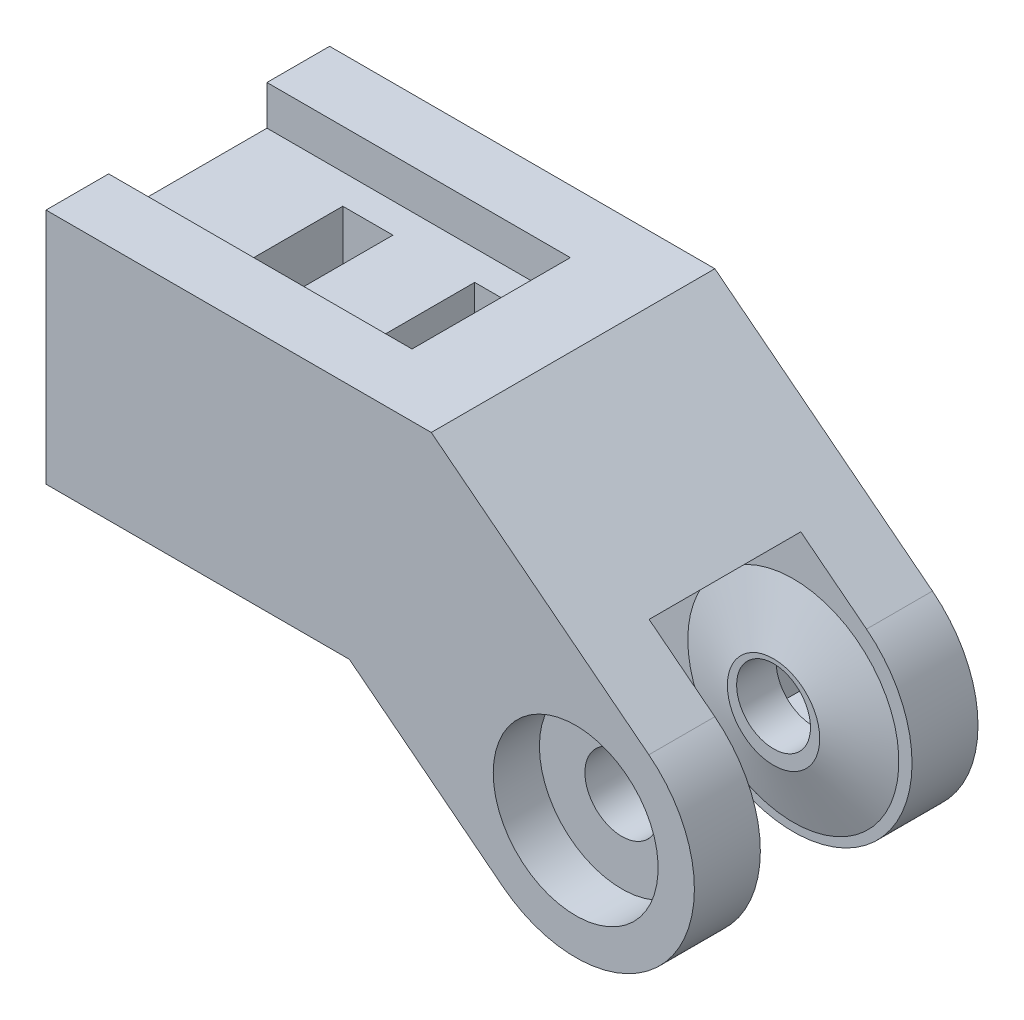
from build123d import *

# Parameters (mm, degrees)
BOSS_EXTRUDE1_DEPTH = 5
SKETCH8_R           = 3.5
BOSS_EXTRUDE5_DEPTH = 1.5
SKETCH10_R          = 8
BOSS_EXTRUDE7_DEPTH = 5.75
SKETCH15_R          = 2.8
CUT_EXTRUDE7_DEPTH  = 10
NUT_CUT_START       = -1.5
SKETCH6_W           = 8.4
SKETCH6_H           = 8.4
NUT_CUT_DEPTH       = 46.182751545
SKETCH16_W          = 12
SKETCH16_H          = 3
CUT_EXTRUDE8_DEPTH  = 23
SKETCH17_R          = 2.35
CUT_EXTRUDE9_DEPTH  = 28
CUT_EXTRUDE10_START = 1.5
SKETCH19_R          = 6.25
CUT_EXTRUDE10_DEPTH = 46.182751545
CUT_EXTRUDE11_START = -8
CUT_EXTRUDE11_DEPTH = 3.8
LPATTERN1_COUNT     = 2
LPATTERN1_PITCH     = 10


with BuildPart() as part:
    # Sketch1 → Boss-Extrude1 (new body)
    with BuildSketch(Plane.XY):
        with BuildLine():
            Line((-40.155138696, -0.836255417), (-17.155138696, -0.836255417))
            Line((-17.155138696, -0.836255417), (-5.547811002, -9.922989015))
            ThreePointArc((-5.547811002, -9.922989015), (7.086733598, -8.384066419), (5.547811002, 4.250478181))
            Line((5.547811002, 4.250478181), (-10.947501986, 17.163744583))
            Line((-10.947501986, 17.163744583), (-40.155138696, 17.163744583))
            Line((-40.155138696, 17.163744583), (-40.155138696, -0.836255417))
        make_face()
    extrude(amount=BOSS_EXTRUDE1_DEPTH)

    # Sketch8 → Boss-Extrude5 (add)
    with BuildSketch(Plane.XY.offset(5)):
        with Locations((0, -3.216528208)):
            Circle(SKETCH8_R)
    extrude(amount=BOSS_EXTRUDE5_DEPTH)

    # Sketch10 → section 0 of loft4
    with BuildSketch(Plane.XY.offset(5), mode=Mode.PRIVATE) as loft4_s0:
        with Locations((0, -3.216528208)):
            Circle(SKETCH10_R)
    # loft up to a face of the part (loft4)
    loft([loft4_s0.sketch, part.faces().sort_by_distance((0, -3.216528208, 6.5))[0]])

    # Sketch14 → Boss-Extrude7 (add)
    with BuildSketch(Plane.XY.offset(5)):
        with BuildLine():
            Line((-40.155138696, -0.836255417), (-40.155138696, 17.163744583))
            Line((-40.155138696, 17.163744583), (-10.947501986, 17.163744583))
            Line((-10.947501986, 17.163744583), (0.567762259, 8.149082357))
            ThreePointArc((0.567762259, 8.149082357), (-8.661563286, 3.944402474), (-10.527859744, -6.024384839))
            Line((-10.527859744, -6.024384839), (-17.155138696, -0.836255417))
            Line((-17.155138696, -0.836255417), (-40.155138696, -0.836255417))
        make_face()
    extrude(amount=BOSS_EXTRUDE7_DEPTH)

    # Sketch15 → Cut-Extrude7 (cut)
    with BuildSketch(Plane(origin=(0, 0, 0), x_dir=(-1, 0, 0), z_dir=(0, 0, -1))):
        with Locations((0, -2.836255417)):
            Circle(SKETCH15_R)
    extrude(amount=-CUT_EXTRUDE7_DEPTH, mode=Mode.SUBTRACT)

    # Mirror1: part across plane


with BuildPart() as part_1:
    add(part.part)
    add(part.part.mirror(Plane(origin=(0, -2.836255417, 10.75), x_dir=(1, 0, 0), z_dir=(0, 0, 1))))

    # Sketch6 → nut-cut (cut, through all)
    with BuildSketch(Plane.XY.offset(5).offset(NUT_CUT_START)):
        with Locations((0, -2.836255417)):
            Rectangle(SKETCH6_W, SKETCH6_H)
    extrude(amount=-NUT_CUT_DEPTH, mode=Mode.SUBTRACT)

    # Sketch16 → Cut-Extrude8 (cut)
    with BuildSketch(Plane.ZY.offset(40.155138696)):
        with Locations((10.75, 0.663744583)):
            Rectangle(SKETCH16_W, SKETCH16_H)
        with Locations((10.75, 15.663744583)):
            Rectangle(SKETCH16_W, SKETCH16_H)
    extrude(amount=-CUT_EXTRUDE8_DEPTH, mode=Mode.SUBTRACT)

    # Sketch17 → Cut-Extrude9 (cut)
    with BuildSketch(Plane.ZY.offset(40.155138696)):
        with Locations((10.75, 8.163744583)):
            Circle(SKETCH17_R)
    extrude(amount=-CUT_EXTRUDE9_DEPTH, mode=Mode.SUBTRACT)

    # Sketch19 → Cut-Extrude10 (cut, through all)
    with BuildSketch(Plane.XY.offset(16.5).offset(CUT_EXTRUDE10_START)):
        with Locations(Location((0, -2.836255417, 0), (0, 0, 180))):
            Circle(SKETCH19_R)
    extrude(amount=CUT_EXTRUDE10_DEPTH, mode=Mode.SUBTRACT)

    # Sketch20 → Cut-Extrude11 (cut)
    with BuildSketch(Plane.ZY.offset(40.155138696).offset(CUT_EXTRUDE11_START)):
        Polygon((7, 14.163744583), (14.5, 14.163744583), (14.5, 5.998681073), (10.75, 3.833617564), (7, 5.998681073), align=None)
    cut_extrude11 = extrude(amount=-CUT_EXTRUDE11_DEPTH, mode=Mode.SUBTRACT)

    # LPattern1: Cut-Extrude11 ×2
    with Locations(*[(i * LPATTERN1_PITCH, 0, 0) for i in range(1, LPATTERN1_COUNT)]):
        add(cut_extrude11, mode=Mode.SUBTRACT)


solid = part_1.part
